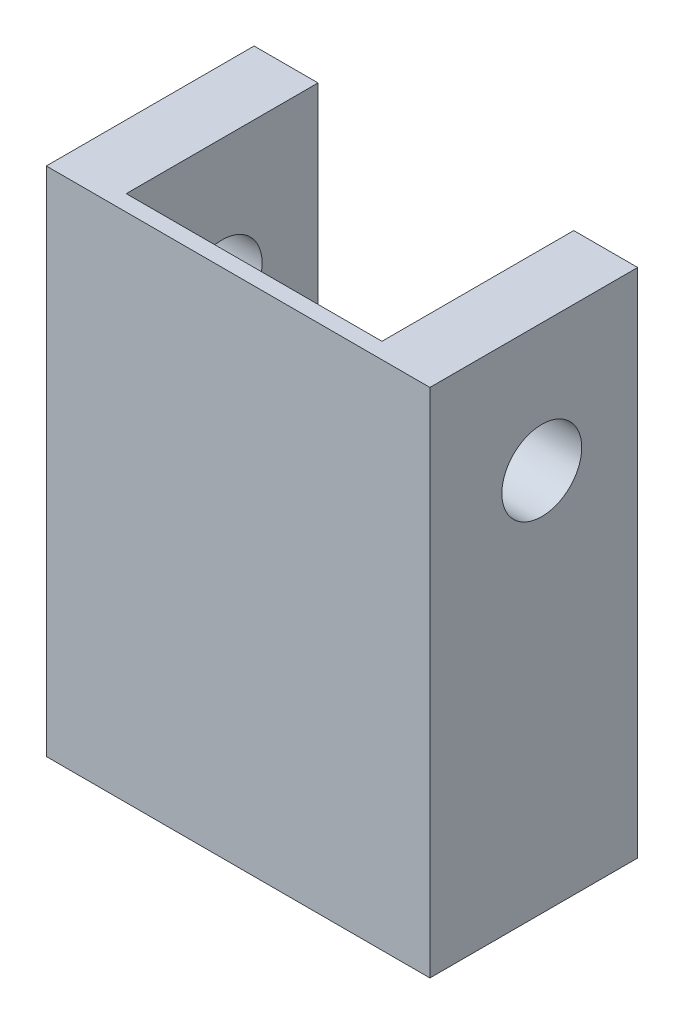
from build123d import *

# Parameters (mm, degrees)
BOSS_EXTRUDE1_DEPTH     = 19.05
CUT_EXTRUDE1_DEPTH      = 111.168382488
CUT_EXTRUDE1_DEPTH_BACK = 111.168382488
SKETCH2_R               = 7.9375
SKETCH3_W               = 76.2
SKETCH3_H               = 101.6
BOSS_EXTRUDE2_DEPTH     = 3.175


with BuildPart() as part:
    # Sketch1 → Boss-Extrude1 (new, symmetric)
    with BuildSketch(Plane.XY):
        Polygon((-38.1, 0), (38.1, 0), (38.1, 101.6), (25.4, 101.6), (25.4, 50.8), (-25.4, 50.8), (-25.4, 101.6), (-38.1, 101.6), align=None)
    extrude(amount=BOSS_EXTRUDE1_DEPTH, both=True)

    # Sketch2 → Cut-Extrude1 (cut, two sides: drawn at the far end of the back side and taken through both)
    with BuildSketch(Plane(origin=(0, 0, 0), x_dir=(0, 0, -1), z_dir=(1, 0, 0)).offset(-CUT_EXTRUDE1_DEPTH_BACK)):
        with Locations((0, 76.2)):
            Circle(SKETCH2_R)
    extrude(amount=CUT_EXTRUDE1_DEPTH + CUT_EXTRUDE1_DEPTH_BACK, mode=Mode.SUBTRACT)

    # Sketch3 → Boss-Extrude2 (add)
    with BuildSketch(Plane.XY.offset(19.05)):
        with Locations((0, 50.8)):
            Rectangle(SKETCH3_W, SKETCH3_H)
    extrude(amount=BOSS_EXTRUDE2_DEPTH)


solid = part.part
